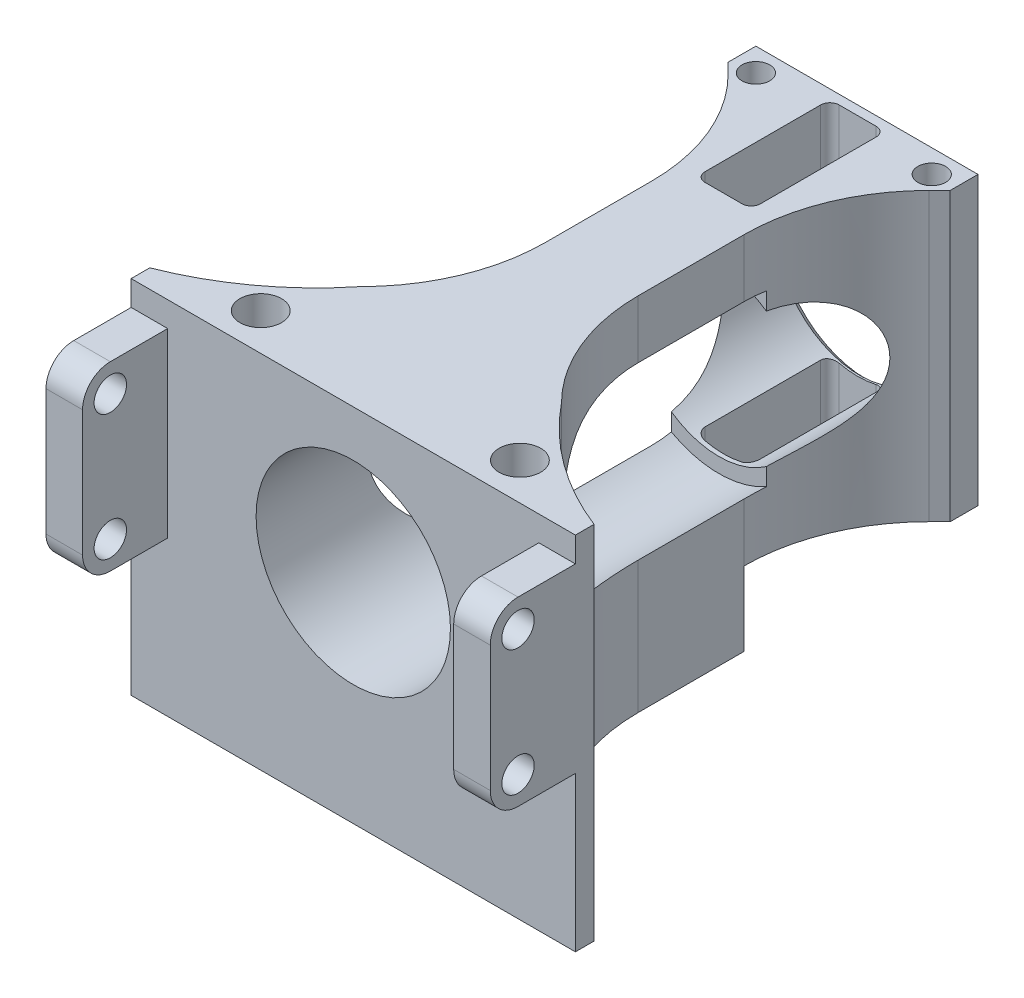
from build123d import *

# Parameters (mm, degrees)
SKETCH_1_W           = 48
SKETCH_1_H           = 31
SKETCH_1_R           = 8.9
EXTRUDE_1_DEPTH      = 65
SKETCH_2_R           = 10.5
CUT_EXTRUDE_1_DEPTH  = 49
CUT_EXTRUDE_3_DEPTH  = 76.907838857
CUT_EXTRUDE_START    = -31
CUT_EXTRUDE_5_DEPTH  = 107.907838984
SKETCH_9_R           = 1.5
CUT_EXTRUDE_6_DEPTH  = 7
CUT_EXTRUDE_START_2  = -24
SKETCH_9_2_R         = 1.5
CUT_EXTRUDE_7_DEPTH  = 7
EXTRUDE_4_DEPTH      = 8
SKETCH_11_R          = 2.25
CUT_EXTRUDE_9_DEPTH  = 80.511005658
SKETCH_14_R          = 1.5
CUT_EXTRUDE_10_DEPTH = 11
SKETCH_15_W          = 40.1
SKETCH_15_H          = 9.5
CUT_EXTRUDE_11_DEPTH = 80.511005658
SKETCH_17_R          = 1.75
CUT_EXTRUDE_13_DEPTH = 85.150163426
SKETCH_19_W          = 3
SKETCH_19_H          = 3
CUT_EXTRUDE_14_DEPTH = 76.651107105
CHAMFER_1_SIZE       = 0.8


with BuildPart() as part:
    # 草图1 → 凸台-拉伸1 (new body)
    with BuildSketch(Plane.XY):
        Rectangle(SKETCH_1_W, SKETCH_1_H)
        Circle(SKETCH_1_R, mode=Mode.SUBTRACT)
    extrude(amount=EXTRUDE_1_DEPTH)

    # 草图2 → 切除-拉伸1 (cut)
    with BuildSketch(Plane.XY.offset(65)):
        Circle(SKETCH_2_R)
    extrude(amount=-CUT_EXTRUDE_1_DEPTH, mode=Mode.SUBTRACT)

    # 草图4 → 切除-拉伸3 (cut, through all)
    with BuildSketch(Plane(origin=(0, 15.5, 0), x_dir=(1, 0, 0), z_dir=(0, 1, 0))):
        with BuildLine():
            Line((-24, 9), (-10.857864376, -4.142135624))
            ThreePointArc((-10.857864376, -4.142135624), (-6.52240935, -10.6306026), (-5, -18.284271247))
            Line((-5, -18.284271247), (-5, -29.715728753))
            ThreePointArc((-5, -29.715728753), (-6.52240935, -37.3693974), (-10.857864376, -43.857864376))
            ThreePointArc((-10.857864376, -43.857864376), (-16.798925034, -49.531146093), (-24, -53.484226727))
            Line((-24, -53.484226727), (-24, 9))
        make_face()
        with BuildLine():
            Line((5, -18.284271247), (5, -29.715728753))
            ThreePointArc((5, -29.715728753), (6.52240935, -37.3693974), (10.857864376, -43.857864376))
            ThreePointArc((10.857864376, -43.857864376), (16.798925034, -49.531146093), (24, -53.484226727))
            Line((24, -53.484226727), (24, 9))
            Line((24, 9), (10.857864376, -4.142135624))
            ThreePointArc((10.857864376, -4.142135624), (6.52240935, -10.6306026), (5, -18.284271247))
        make_face()
    extrude(amount=-CUT_EXTRUDE_3_DEPTH, mode=Mode.SUBTRACT)

    # 草图6 → 切除-拉伸5 (cut, through all)
    with BuildSketch(Plane(origin=(0, 15.5, 0), x_dir=(1, 0, 0), z_dir=(0, 1, 0)).offset(CUT_EXTRUDE_START)):
        with BuildLine():
            Line((-2, -1), (2, -1))
            ThreePointArc((2, -1), (2.707106781, -1.292893219), (3, -2))
            Line((3, -2), (3, -14.5))
            ThreePointArc((3, -14.5), (2.707106781, -15.207106781), (2, -15.5))
            Line((2, -15.5), (-2, -15.5))
            ThreePointArc((-2, -15.5), (-2.707106781, -15.207106781), (-3, -14.5))
            Line((-3, -14.5), (-3, -2))
            ThreePointArc((-3, -2), (-2.707106781, -1.292893219), (-2, -1))
        make_face()
    extrude(amount=CUT_EXTRUDE_5_DEPTH, mode=Mode.SUBTRACT)

    # 草图9 → 切除-拉伸6 (cut)
    with BuildSketch(Plane(origin=(0, 15.5, 0), x_dir=(1, 0, 0), z_dir=(0, 1, 0))):
        with Locations(Location((9.5, -2.5, 0), (0, 0, 270))):
            Circle(SKETCH_9_R)
        with Locations(Location((-9.5, -2.5, 0), (0, 0, 270))):
            Circle(SKETCH_9_R)
    extrude(amount=-CUT_EXTRUDE_6_DEPTH, mode=Mode.SUBTRACT)

    # 草图9<2> → 切除-拉伸7 (cut)
    with BuildSketch(Plane(origin=(0, 15.5, 0), x_dir=(1, 0, 0), z_dir=(0, 1, 0)).offset(CUT_EXTRUDE_START_2)):
        with Locations(Location((9.5, -2.5, 0), (0, 0, 270))):
            Circle(SKETCH_9_2_R)
        with Locations(Location((-9.5, -2.5, 0), (0, 0, 270))):
            Circle(SKETCH_9_2_R)
    extrude(amount=-CUT_EXTRUDE_7_DEPTH, mode=Mode.SUBTRACT)

    # 草图12 → 凸台-拉伸4 (add)
    with BuildSketch(Plane.XZ.offset(15.5)):
        with BuildLine():
            Line((-5, 18.284271247), (5, 18.284271247))
            Line((5, 18.284271247), (5, 29.715728753))
            ThreePointArc((5, 29.715728753), (6.52240935, 37.3693974), (10.857864376, 43.857864376))
            ThreePointArc((10.857864376, 43.857864376), (16.798925034, 49.531146093), (24, 53.484226727))
            Line((24, 53.484226727), (24, 65))
            Line((24, 65), (-24, 65))
            Line((-24, 65), (-24, 53.484226727))
            ThreePointArc((-24, 53.484226727), (-16.798925034, 49.531146093), (-10.857864376, 43.857864376))
            ThreePointArc((-10.857864376, 43.857864376), (-6.52240935, 37.3693974), (-5, 29.715728753))
            Line((-5, 29.715728753), (-5, 18.284271247))
        make_face()
    extrude(amount=EXTRUDE_4_DEPTH)

    # 草图11 → 切除-拉伸9 (cut, through all)
    with BuildSketch(Plane(origin=(0, 15.5, 0), x_dir=(1, 0, 0), z_dir=(0, 1, 0))):
        with Locations(Location((14, -51.5, 0), (0, 0, 270))):
            Circle(SKETCH_11_R)
        with Locations(Location((-14, -51.5, 0), (0, 0, 270))):
            Circle(SKETCH_11_R)
    extrude(amount=-CUT_EXTRUDE_9_DEPTH, mode=Mode.SUBTRACT)

    # 草图14 → 切除-拉伸10 (cut)
    with BuildSketch(Plane.XZ.offset(23.5)):
        with Locations(Location((0, 24, 0), (0, 0, 270))):
            Circle(SKETCH_14_R)
    extrude(amount=-CUT_EXTRUDE_10_DEPTH, mode=Mode.SUBTRACT)

    # 草图15 → 切除-拉伸11 (cut, through all)
    with BuildSketch(Plane(origin=(0, 15.5, 0), x_dir=(1, 0, 0), z_dir=(0, 1, 0))):
        with Locations((0, -60.25)):
            Rectangle(SKETCH_15_W, SKETCH_15_H)
    extrude(amount=-CUT_EXTRUDE_11_DEPTH, mode=Mode.SUBTRACT)

    # 草图17 → 切除-拉伸13 (cut, through all)
    with BuildSketch(Plane(origin=(24, 0, 0), x_dir=(0, 0, -1), z_dir=(1, 0, 0))):
        with Locations((-61.7, 9.8)):
            Circle(SKETCH_17_R)
        with Locations((-61.7, -3.8)):
            Circle(SKETCH_17_R)
        with BuildLine():
            Line((-55.5, -23.5), (-55.5, -6.8))
            Line((-55.5, -6.8), (-61.7, -6.8))
            ThreePointArc((-61.7, -6.8), (-63.821320344, -5.921320344), (-64.7, -3.8))
            Line((-64.7, -3.8), (-64.7, 9.8))
            ThreePointArc((-64.7, 9.8), (-63.821320344, 11.921320344), (-61.7, 12.8))
            Line((-61.7, 12.8), (-55.5, 12.8))
            Line((-55.5, 12.8), (-55.5, 15.5))
            Line((-55.5, 15.5), (-64.7, 15.5))
            Line((-64.7, 15.5), (-94.5, 15.5))
            Line((-94.5, 15.5), (-94.5, -23.5))
            Line((-94.5, -23.5), (-55.5, -23.5))
        make_face()
    extrude(amount=-CUT_EXTRUDE_13_DEPTH, mode=Mode.SUBTRACT)

    # 草图19 → 切除-拉伸14 (cut, through all)
    with BuildSketch(Plane.XZ.offset(15.5)):
        with Locations((-13.5, 1.5)):
            Rectangle(SKETCH_19_W, SKETCH_19_H)
        with Locations((13.5, 1.5)):
            Rectangle(SKETCH_19_W, SKETCH_19_H)
    extrude(amount=-CUT_EXTRUDE_14_DEPTH, mode=Mode.SUBTRACT)

    # 倒角1
    chamfer_1_edges = [part.edges().sort_by_distance(p)[0] for p in [
        (-8.9, 0, 0),
    ]]
    chamfer(chamfer_1_edges, length=CHAMFER_1_SIZE)


solid = part.part
